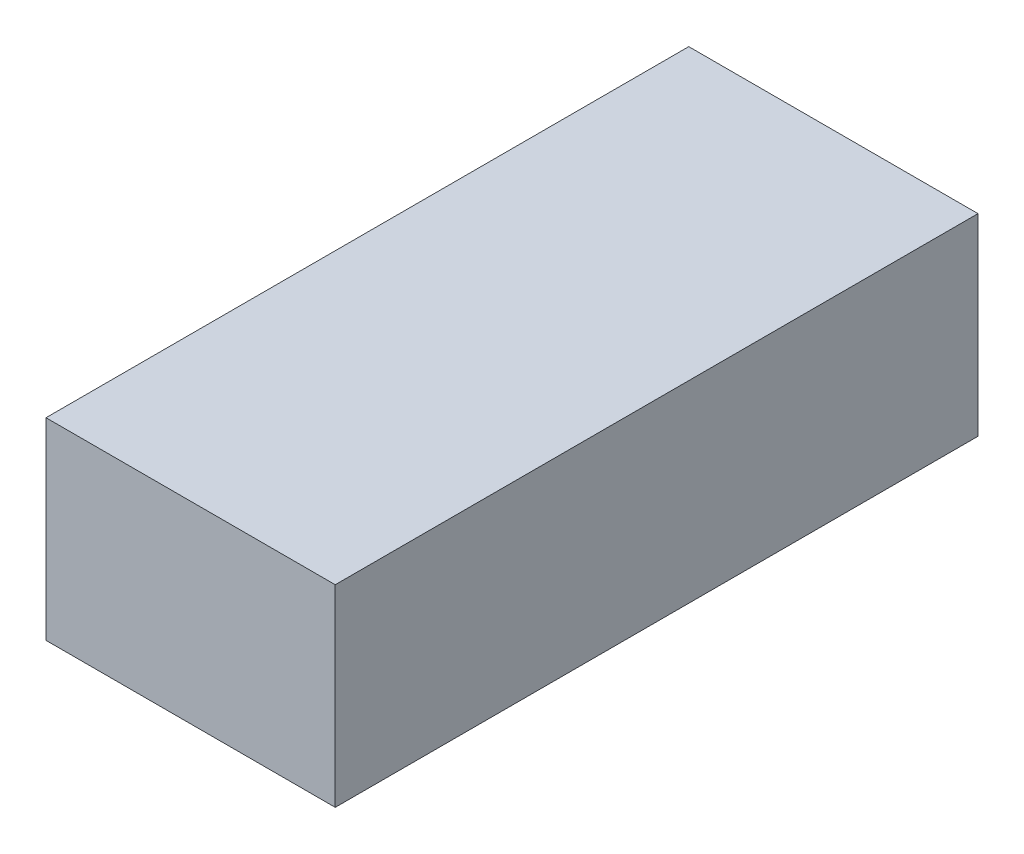
from build123d import *

# Parameters (mm, degrees)
SKETCH1_W           = 4.5
SKETCH1_H           = 10
BOSS_EXTRUDE1_DEPTH = 3


with BuildPart() as part:
    # Sketch1 → Boss-Extrude1 (new body)
    with BuildSketch(Plane(origin=(0, 0, 0), x_dir=(1, 0, 0), z_dir=(0, 1, 0))):
        Rectangle(SKETCH1_W, SKETCH1_H)
    extrude(amount=BOSS_EXTRUDE1_DEPTH)


solid = part.part
